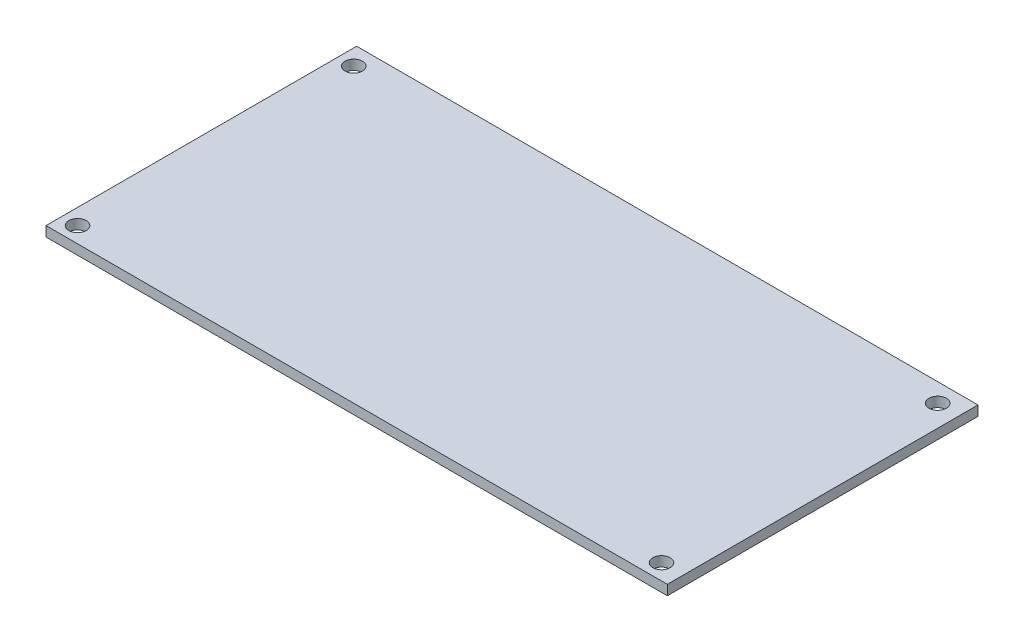
from build123d import *

# Parameters (mm, degrees)
SKETCH1_W           = 100
SKETCH1_H           = 50
SKETCH1_R           = 1.397
BOSS_EXTRUDE1_DEPTH = 1.6


with BuildPart() as part:
    # Sketch1 → Boss-Extrude1 (new body)
    with BuildSketch(Plane(origin=(0, 0, 0), x_dir=(1, 0, 0), z_dir=(0, 1, 0))):
        with Locations((12.075671401, 1.159327059)):
            Rectangle(SKETCH1_W, SKETCH1_H)
        with Locations(Location((-35.384328599, 23.149327059, 0), (0, 0, 270))):
            Circle(SKETCH1_R, mode=Mode.SUBTRACT)
        with Locations(Location((-35.384328599, -21.300672941, 0), (0, 0, 270))):
            Circle(SKETCH1_R, mode=Mode.SUBTRACT)
        with Locations(Location((58.595671401, -21.300672941, 0), (0, 0, 270))):
            Circle(SKETCH1_R, mode=Mode.SUBTRACT)
        with Locations(Location((58.595671401, 23.149327059, 0), (0, 0, 270))):
            Circle(SKETCH1_R, mode=Mode.SUBTRACT)
    extrude(amount=BOSS_EXTRUDE1_DEPTH)


solid = part.part
